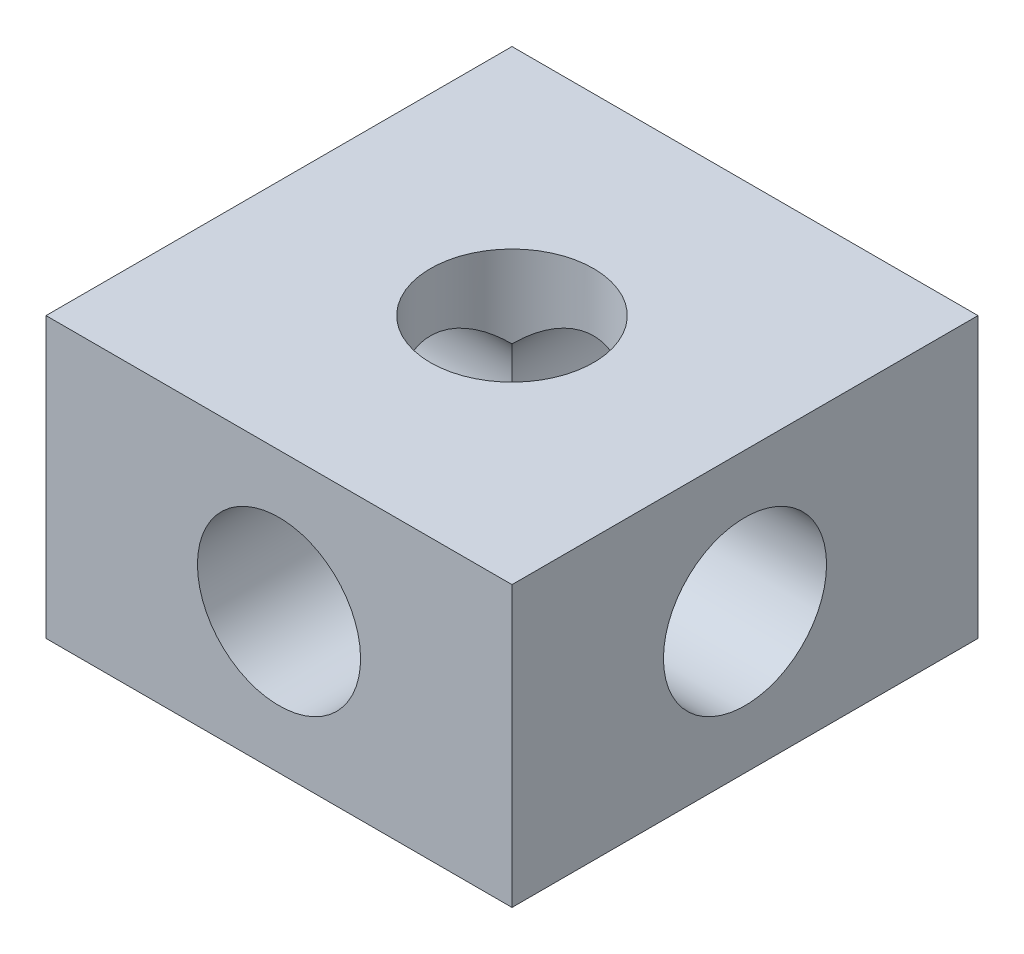
from build123d import *

# Parameters (mm, degrees)
SKETCH_1_W          = 10
SKETCH_1_H          = 10
SKETCH_1_R          = 1.75
EXTRUDE_1_DEPTH     = 3
SKETCH_3_R          = 1.75
CUT_EXTRUDE_1_DEPTH = 8.5
SKETCH_4_R          = 1.75
CUT_EXTRUDE_2_DEPTH = 8.5


with BuildPart() as part:
    # 草图1 → 凸台-拉伸1 (new, symmetric)
    with BuildSketch(Plane(origin=(0, 0, 0), x_dir=(1, 0, 0), z_dir=(0, 1, 0))):
        Rectangle(SKETCH_1_W, SKETCH_1_H)
        with Locations(Location((0, 0, 0), (0, 0, 270))):
            Circle(SKETCH_1_R, mode=Mode.SUBTRACT)
    extrude(amount=EXTRUDE_1_DEPTH, both=True)

    # 草图3 → 切除-拉伸1 (cut, symmetric)
    with BuildSketch(Plane.XY):
        Circle(SKETCH_3_R)
    extrude(amount=CUT_EXTRUDE_1_DEPTH, both=True, mode=Mode.SUBTRACT)

    # 草图4 → 切除-拉伸2 (cut, symmetric)
    with BuildSketch(Plane(origin=(0, 0, 0), x_dir=(0, 0, -1), z_dir=(1, 0, 0))):
        Circle(SKETCH_4_R)
    extrude(amount=CUT_EXTRUDE_2_DEPTH, both=True, mode=Mode.SUBTRACT)


solid = part.part
